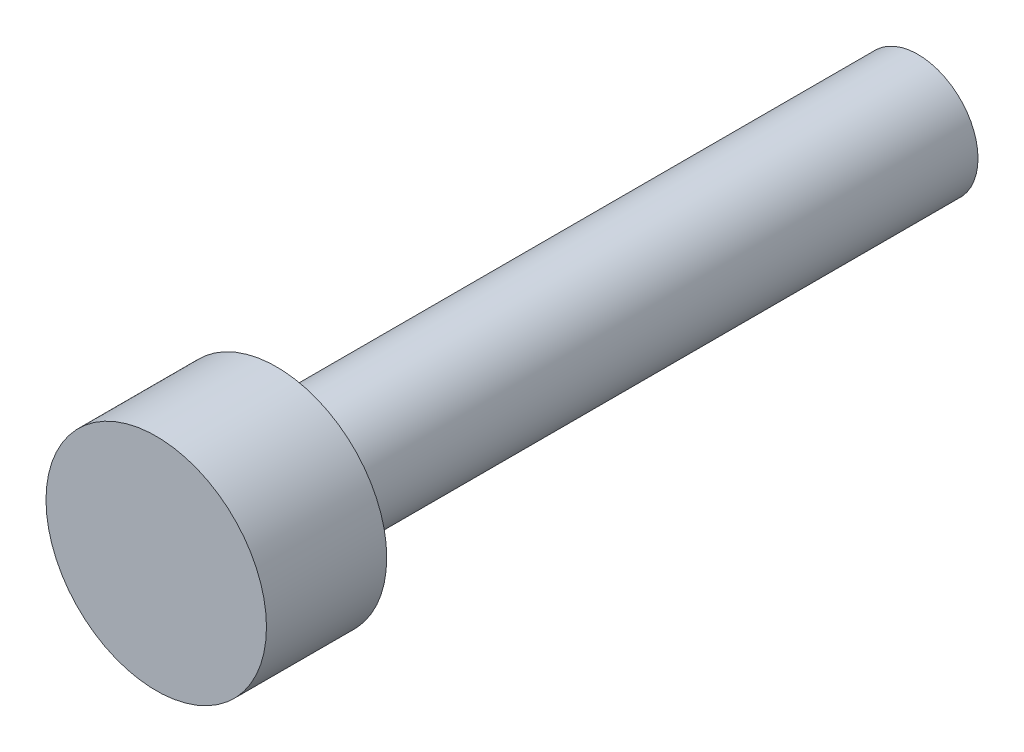
from build123d import *

# Parameters (mm, degrees)
SHANK_NOMINAL_THREAD_ENVELOPE_START     = -16
SHANK_NOMINAL_THREAD_ENVELOPE_PROFILE_R = 1.5
SHANK_NOMINAL_THREAD_ENVELOPE_DEPTH     = 16
SOCKET_HEAD_ENVELOPE_PROFILE_R          = 2.75
SOCKET_HEAD_ENVELOPE_DEPTH              = 3


with BuildPart() as part:
    # Shank_nominal_thread_envelope_profile → Shank_nominal_thread_envelope (new body)
    with BuildSketch(Plane.XY.offset(SHANK_NOMINAL_THREAD_ENVELOPE_START)):
        Circle(SHANK_NOMINAL_THREAD_ENVELOPE_PROFILE_R)
    extrude(amount=SHANK_NOMINAL_THREAD_ENVELOPE_DEPTH)

    # Socket_head_envelope_profile → Socket_head_envelope (add)
    with BuildSketch(Plane.XY):
        Circle(SOCKET_HEAD_ENVELOPE_PROFILE_R)
    extrude(amount=SOCKET_HEAD_ENVELOPE_DEPTH)


solid = part.part
